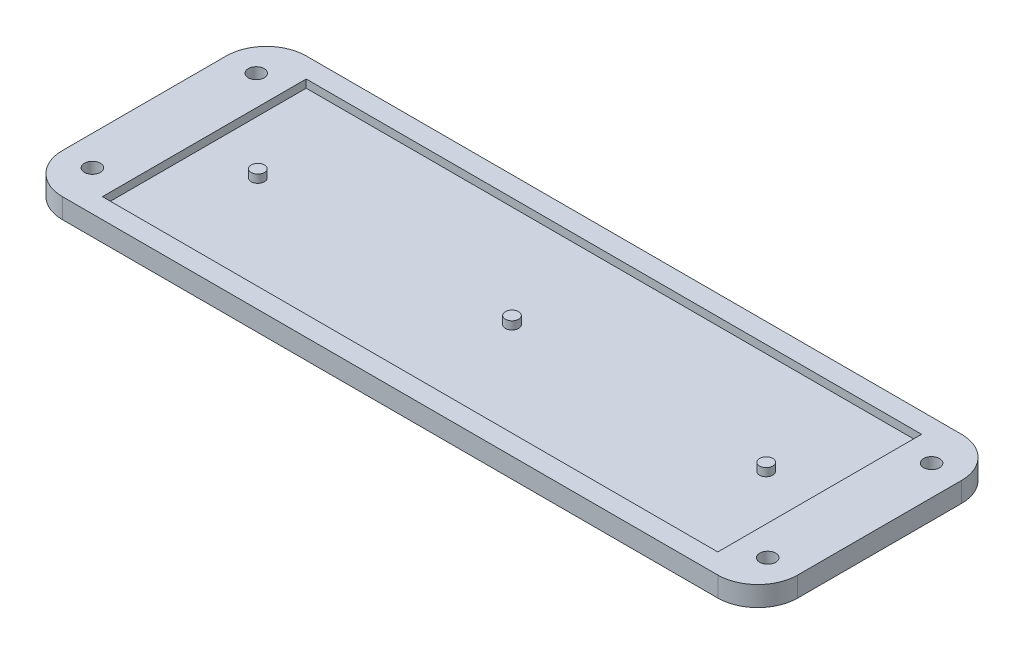
from build123d import *

# Parameters (mm, degrees)
SKETCH2_W           = 184
SKETCH2_H           = 61
SKETCH2_R           = 2
BOSS_EXTRUDE1_DEPTH = 5
SKETCH3_W           = 154
SKETCH3_H           = 51
SKETCH3_R           = 1.65
CUT_EXTRUDE1_DEPTH  = 2
FILLET1_R           = 10


with BuildPart() as part:
    # Sketch2 → Boss-Extrude1 (new body)
    with BuildSketch(Plane(origin=(0, 0, 0), x_dir=(1, 0, 0), z_dir=(0, 1, 0))):
        with Locations((92, 30.5)):
            Rectangle(SKETCH2_W, SKETCH2_H)
        with Locations(Location((7.5, 10, 0), (0, 0, 270))):
            Circle(SKETCH2_R, mode=Mode.SUBTRACT)
        with Locations(Location((176.5, 10, 0), (0, 0, 90))):
            Circle(SKETCH2_R, mode=Mode.SUBTRACT)
        with Locations(Location((176.5, 51, 0), (0, 0, 270))):
            Circle(SKETCH2_R, mode=Mode.SUBTRACT)
        with Locations(Location((7.5, 51, 0), (0, 0, 90))):
            Circle(SKETCH2_R, mode=Mode.SUBTRACT)
    extrude(amount=BOSS_EXTRUDE1_DEPTH)

    # Sketch3 → Cut-Extrude1 (cut)
    with BuildSketch(Plane(origin=(0, 5, 0), x_dir=(1, 0, 0), z_dir=(0, 1, 0))):
        with Locations((92, 30.5)):
            Rectangle(SKETCH3_W, SKETCH3_H)
        with Locations(Location((92, 30.5, 0), (0, 0, 270))):
            Circle(SKETCH3_R, mode=Mode.SUBTRACT)
        with Locations(Location((28.4, 30.5, 0), (0, 0, 270))):
            Circle(SKETCH3_R, mode=Mode.SUBTRACT)
        with Locations(Location((155.6, 30.5, 0), (0, 0, 270))):
            Circle(SKETCH3_R, mode=Mode.SUBTRACT)
    extrude(amount=-CUT_EXTRUDE1_DEPTH, mode=Mode.SUBTRACT)

    # Fillet1
    fillet1_edges = [part.edges().sort_by_distance(p)[0] for p in [
        (0, 2.5, -61),
        (184, 2.5, -61),
        (184, 2.5, 0),
        (0, 2.5, 0),
    ]]
    fillet(fillet1_edges, radius=FILLET1_R)


solid = part.part
